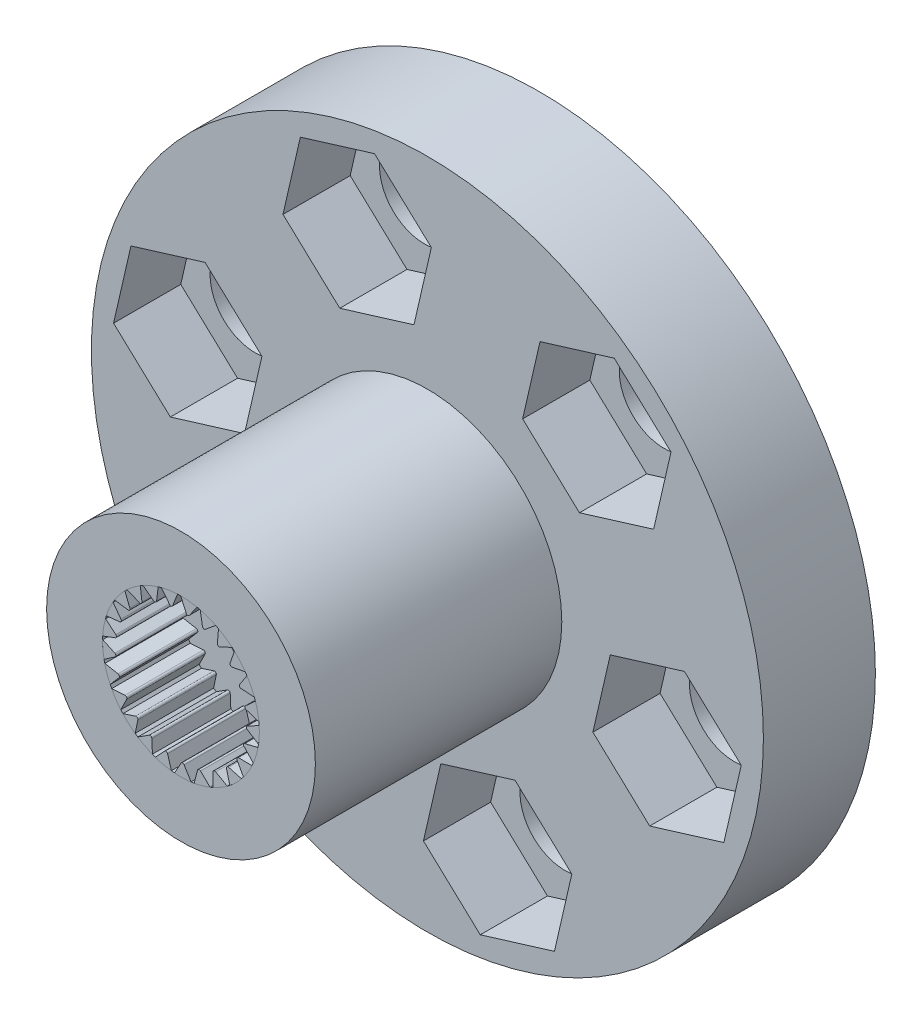
from build123d import *

# Parameters (mm, degrees)
SKETCH_1_R          = 15
EXTRUDE_1_DEPTH     = 5
SKETCH_2_R          = 2
CUT_EXTRUDE_1_DEPTH = 58.459224673
SKETCH_3_R          = 6
SKETCH_3_R_2        = 3.5
EXTRUDE_2_DEPTH     = 11
SKETCH_4_R          = 3.5
EXTRUDE_3_DEPTH     = 7.5
SKETCH_5_R          = 4
CUT_EXTRUDE_2_DEPTH = 10
SKETCH_6_R          = 1.5
CUT_EXTRUDE_3_DEPTH = 8
CUT_EXTRUDE_4_DEPTH = 3
EXTRUDE_4_DEPTH     = 3.5


with BuildPart() as part:
    # 草图1 → 凸台-拉伸1 (new body)
    with BuildSketch(Plane.XY):
        with Locations((-15, -33.75)):
            Circle(SKETCH_1_R)
    extrude(amount=EXTRUDE_1_DEPTH)

    # 草图2 → 切除-拉伸1 (cut, through all)
    with BuildSketch(Plane.XY.offset(5)):
        with Locations((-18.135560105, -23.206363871)):
            Circle(SKETCH_2_R)
        with Locations((-7.436723316, -25.76270723)):
            Circle(SKETCH_2_R)
        with Locations((-4.301163211, -36.306343359)):
            Circle(SKETCH_2_R)
        with Locations((-11.864439895, -44.293636129)):
            Circle(SKETCH_2_R)
        with Locations((-22.563276684, -41.73729277)):
            Circle(SKETCH_2_R)
        with Locations((-25.698836789, -31.193656641)):
            Circle(SKETCH_2_R)
    extrude(amount=-CUT_EXTRUDE_1_DEPTH, mode=Mode.SUBTRACT)

    # 草图3 → 凸台-拉伸2 (add)
    with BuildSketch(Plane.XY.offset(5)):
        with Locations((-15, -33.75)):
            Circle(SKETCH_3_R)
        with Locations((-15, -33.75)):
            Circle(SKETCH_3_R_2, mode=Mode.SUBTRACT)
    extrude(amount=EXTRUDE_2_DEPTH)

    # 草图4 → 凸台-拉伸3 (add)
    with BuildSketch(Plane.XY.offset(5)):
        with Locations((-15, -33.75)):
            Circle(SKETCH_4_R)
    extrude(amount=EXTRUDE_3_DEPTH)

    # 草图5 → 切除-拉伸2 (cut)
    with BuildSketch(Plane(origin=(0, 0, 0), x_dir=(-1, 0, 0), z_dir=(0, 0, -1))):
        with Locations((15, -33.75)):
            Circle(SKETCH_5_R)
    extrude(amount=-CUT_EXTRUDE_2_DEPTH, mode=Mode.SUBTRACT)

    # 草图6 → 切除-拉伸3 (cut)
    with BuildSketch(Plane(origin=(0, 0, 10), x_dir=(-1, 0, 0), z_dir=(0, 0, -1))):
        with Locations((15, -33.75)):
            Circle(SKETCH_6_R)
    extrude(amount=-CUT_EXTRUDE_3_DEPTH, mode=Mode.SUBTRACT)

    # 草图8 → 切除-拉伸4 (cut)
    with BuildSketch(Plane.XY.offset(5)):
        Polygon((-4.125116269, -24.746213861), (-6.661228872, -22.386524716), (-9.972835919, -23.403018084), (-10.748330363, -26.779200598), (-8.21221776, -29.138889744), (-4.900610713, -28.122396375), align=None)
        Polygon((-17.360065661, -19.830181357), (-20.671672708, -20.846674725), (-21.447167151, -24.222857239), (-18.911054548, -26.582546385), (-15.599447502, -25.566053016), (-14.823953058, -22.189870502), align=None)
        Polygon((-1.765050608, -38.666032505), (-0.989556165, -35.289849991), (-3.525668768, -32.930160845), (-6.837275814, -33.946654213), (-7.612770258, -37.322836727), (-5.076657655, -39.682525873), align=None)
        Polygon((-12.639934339, -47.669818643), (-9.328327292, -46.653325275), (-8.552832849, -43.277142761), (-11.088945452, -40.917453615), (-14.400552498, -41.933946984), (-15.176046942, -45.310129498), align=None)
        Polygon((-25.874883731, -42.753786139), (-23.338771128, -45.113475284), (-20.027164081, -44.096981916), (-19.251669637, -40.720799402), (-21.78778224, -38.361110256), (-25.099389287, -39.377603625), align=None)
        Polygon((-28.234949392, -28.833967495), (-29.010443835, -32.210150009), (-26.474331232, -34.569839155), (-23.162724186, -33.553345787), (-22.387229742, -30.177163273), (-24.923342345, -27.817474127), align=None)
    extrude(amount=-CUT_EXTRUDE_4_DEPTH, mode=Mode.SUBTRACT)


with BuildPart() as body_2:
    # 草图9 → 凸台-拉伸4 (new body)
    with BuildSketch(Plane.XY.offset(16)):
        with BuildLine():
            Line((-17.90861252, -33.196490101), (-18.372741639, -32.814792088))
            ThreePointArc((-18.372741639, -32.814792088), (-18.452665259, -33.176325345), (-18.493948882, -33.544278797))
            Line((-18.493948882, -33.544278797), (-17.931324146, -33.333180196))
            ThreePointArc((-17.931324146, -33.333180196), (-17.880509302, -33.27139143), (-17.90861252, -33.196490101))
        make_face()
        with BuildLine():
            Line((-17.954885423, -33.937222152), (-18.499357508, -33.682940102))
            ThreePointArc((-18.499357508, -33.682940102), (-18.486860516, -34.052991322), (-18.435340835, -34.41965166))
            Line((-18.435340835, -34.41965166), (-17.942890078, -34.075266028))
            ThreePointArc((-17.942890078, -34.075266028), (-17.909037916, -34.002781332), (-17.954885423, -33.937222152))
        make_face()
        with BuildLine():
            Line((-17.815492008, -34.666190346), (-18.406095876, -34.555301736))
            ThreePointArc((-18.406095876, -34.555301736), (-18.301963503, -34.910619241), (-18.16087769, -35.252947846))
            Line((-18.16087769, -35.252947846), (-17.769543403, -34.796914199))
            ThreePointArc((-17.769543403, -34.796914199), (-17.75478098, -34.718288053), (-17.815492008, -34.666190346))
        make_face()
        with BuildLine():
            Line((-17.499190876, -35.337590932), (-18.098816713, -35.3770633))
            ThreePointArc((-18.098816713, -35.3770633), (-17.90959198, -35.695321185), (-17.687804975, -35.991808292))
            Line((-17.687804975, -35.991808292), (-17.42217613, -35.452780901))
            ThreePointArc((-17.42217613, -35.452780901), (-17.427431023, -35.372953674), (-17.499190876, -35.337590932))
        make_face()
        with BuildLine():
            Line((-17.025856389, -35.90923734), (-17.596827499, -36.096590493))
            ThreePointArc((-17.596827499, -36.096590493), (-17.334400091, -36.357791444), (-17.045847588, -36.589807678))
            Line((-17.045847588, -36.589807678), (-16.922614623, -36.001655616))
            ThreePointArc((-16.922614623, -36.001655616), (-16.947556648, -35.925643147), (-17.025856389, -35.90923734))
        make_face()
        with BuildLine():
            Line((-16.425229895, -36.345210925), (-16.931670063, -36.668672775))
            ThreePointArc((-16.931670063, -36.668672775), (-16.61252926, -36.856404575), (-16.275342073, -37.009371504))
            Line((-16.275342073, -37.009371504), (-16.302248168, -36.409050528))
            ThreePointArc((-16.302248168, -36.409050528), (-16.345310126, -36.34162896), (-16.425229895, -36.345210925))
        make_face()
        with BuildLine():
            Line((-15.735050965, -36.618117864), (-16.145138692, -37.057364113))
            ThreePointArc((-16.145138692, -37.057364113), (-15.789337285, -37.159830883), (-15.424702125, -37.22413703))
            Line((-15.424702125, -37.22413703), (-15.600056671, -36.649367516))
            ThreePointArc((-15.600056671, -36.649367516), (-15.65853282, -36.594773194), (-15.735050965, -36.618117864))
        make_face()
        with BuildLine():
            Line((-14.998686079, -36.710810408), (-15.286654047, -37.2382416))
            ThreePointArc((-15.286654047, -37.2382416), (-14.916548345, -37.249004976), (-14.54737658, -37.22060975))
            Line((-14.54737658, -37.22060975), (-14.860161407, -36.70750658))
            ThreePointArc((-14.860161407, -36.70750658), (-14.930377476, -36.669169866), (-14.998686079, -36.710810408))
        make_face()
        with BuildLine():
            ThreePointArc((-14.410157873, -37.199940038), (-14.04900298, -37.118323718), (-13.69849103, -36.999011296))
            Line((-13.69849103, -36.999011296), (-14.129052716, -36.579814628))
            ThreePointArc((-14.129052716, -36.579814628), (-14.206596772, -36.560144359), (-14.262403752, -36.617464346))
            Line((-14.262403752, -36.617464346), (-14.410157873, -37.199940038))
        make_face()
        with BuildLine():
            ThreePointArc((-13.570723649, -36.944866055), (-13.241212254, -36.775998292), (-12.931384075, -36.573265513))
            Line((-12.931384075, -36.573265513), (-13.452668846, -36.274315016))
            ThreePointArc((-13.452668846, -36.274315016), (-13.532668509, -36.274547147), (-13.57246731, -36.343944953))
            Line((-13.57246731, -36.343944953), (-13.570723649, -36.944866055))
        make_face()
        with BuildLine():
            ThreePointArc((-12.821096115, -36.489046889), (-12.543932632, -36.243538266), (-12.294255867, -35.970123574))
            Line((-12.294255867, -35.970123574), (-12.873509483, -35.810203408))
            ThreePointArc((-12.873509483, -35.810203408), (-12.950938081, -35.830323353), (-12.972227997, -35.907438459))
            Line((-12.972227997, -35.907438459), (-12.821096115, -36.489046889))
        make_face()
        with BuildLine():
            Line((-17.679580795, -32.490537113), (-18.034204008, -32.005406627))
            ThreePointArc((-18.034204008, -32.005406627), (-18.201526345, -32.335705455), (-18.33301927, -32.681832154))
            Line((-18.33301927, -32.681832154), (-17.735572338, -32.617284685))
            ThreePointArc((-17.735572338, -32.617284685), (-17.670987694, -32.570074265), (-17.679580795, -32.490537113))
        make_face()
        with BuildLine():
            Line((-17.282181154, -31.86372081), (-17.505016181, -31.305640383))
            ThreePointArc((-17.505016181, -31.305640383), (-17.749223757, -31.583950893), (-17.962663799, -31.886502425))
            Line((-17.962663799, -31.886502425), (-17.367934459, -31.972561844))
            ThreePointArc((-17.367934459, -31.972561844), (-17.293638106, -31.942896174), (-17.282181154, -31.86372081))
        make_face()
        with BuildLine():
            Line((-16.741383677, -31.355426366), (-16.818428974, -30.759462244))
            ThreePointArc((-16.818428974, -30.759462244), (-17.12417733, -30.968297163), (-17.406153266, -31.208263102))
            Line((-17.406153266, -31.208263102), (-16.851510549, -31.439521979))
            ThreePointArc((-16.851510549, -31.439521979), (-16.772170801, -31.429265062), (-16.741383677, -31.355426366))
        make_face()
        with BuildLine():
            Line((-16.09116866, -30.99759179), (-16.017583186, -30.401190591))
            ThreePointArc((-16.017583186, -30.401190591), (-16.193292596, -30.459703238), (-16.365661028, -30.527428053))
            Line((-16.365661028, -30.527428053), (-16.139351486, -31.061454261))
            ThreePointArc((-16.139351486, -31.061454261), (-16.106704124, -31.0359783), (-16.09116866, -30.99759179))
        make_face()
        with BuildLine():
            Line((-16.139351486, -31.061454261), (-16.365661028, -30.527428053))
            ThreePointArc((-16.365661028, -30.527428053), (-16.534205885, -30.604175418), (-16.698455274, -30.689730456))
            Line((-16.698455274, -30.689730456), (-16.218749422, -31.051657945))
            ThreePointArc((-16.218749422, -31.051657945), (-16.180362912, -31.067193409), (-16.139351486, -31.061454261))
        make_face()
        with BuildLine():
            ThreePointArc((-15.509409787, -30.833340666), (-15.434942528, -30.862574677), (-15.372391503, -30.812701144))
            Line((-15.372391503, -30.812701144), (-15.152798905, -30.253336949))
            ThreePointArc((-15.152798905, -30.253336949), (-15.521335222, -30.289044989), (-15.884037091, -30.363485801))
            Line((-15.884037091, -30.363485801), (-15.509409787, -30.833340666))
        make_face()
        with BuildLine():
            ThreePointArc((-14.278413707, -30.325191506), (-14.644252006, -30.268126458), (-15.014071606, -30.250028287))
            Line((-15.014071606, -30.250028287), (-14.768062061, -30.79828782))
            ThreePointArc((-14.768062061, -30.79828782), (-14.703204531, -30.845122645), (-14.630215618, -30.812371788))
            Line((-14.630215618, -30.812371788), (-14.278413707, -30.325191506))
        make_face()
        with BuildLine():
            ThreePointArc((-13.449368429, -30.612239376), (-13.789521745, -30.465986846), (-14.143221951, -30.356486868))
            Line((-14.143221951, -30.356486868), (-14.041287849, -30.948701906))
            ThreePointArc((-14.041287849, -30.948701906), (-13.990115284, -31.01019474), (-13.911274646, -30.996624417))
            Line((-13.911274646, -30.996624417), (-13.449368429, -30.612239376))
        make_face()
        with BuildLine():
            ThreePointArc((-12.717755036, -31.096444286), (-13.010850285, -30.870193859), (-13.326206811, -30.67617236))
            Line((-13.326206811, -30.67617236), (-13.374753047, -31.275131854))
            ThreePointArc((-13.374753047, -31.275131854), (-13.340480809, -31.347418877), (-13.260742292, -31.353881759))
            Line((-13.260742292, -31.353881759), (-12.717755036, -31.096444286))
        make_face()
        with BuildLine():
            ThreePointArc((-12.129543487, -31.747381861), (-12.357164416, -31.455349683), (-12.614362253, -31.188997747))
            Line((-12.614362253, -31.188997747), (-12.810338489, -31.757066869))
            ThreePointArc((-12.810338489, -31.757066869), (-12.795120027, -31.835606021), (-12.719493896, -31.861696023))
            Line((-12.719493896, -31.861696023), (-12.129543487, -31.747381861))
        make_face()
        with BuildLine():
            ThreePointArc((-11.721693278, -32.524151299), (-11.869537628, -32.184686825), (-12.052416088, -31.862740325))
            Line((-12.052416088, -31.862740325), (-12.383508416, -32.364225202))
            ThreePointArc((-12.383508416, -32.364225202), (-12.388299964, -32.44408158), (-12.321538086, -32.488159371))
            Line((-12.321538086, -32.488159371), (-11.721693278, -32.524151299))
        make_face()
        with BuildLine():
            ThreePointArc((-11.519831137, -33.377945319), (-11.578609303, -33.012378351), (-11.675677461, -32.655066368))
            Line((-11.675677461, -32.655066368), (-12.121082132, -33.058456862))
            ThreePointArc((-12.121082132, -33.058456862), (-12.145582618, -33.134612796), (-12.091879888, -33.193908806))
            Line((-12.091879888, -33.193908806), (-11.519831137, -33.377945319))
        make_face()
        with BuildLine():
            ThreePointArc((-11.5, -33.75), (-11.501955107, -33.63303022), (-11.507818245, -33.516191119))
            Line((-11.507818245, -33.516191119), (-12.039548846, -33.796140721))
            ThreePointArc((-12.039548846, -33.796140721), (-12.082218815, -33.863811053), (-12.044949573, -33.934599496))
            Line((-12.044949573, -33.934599496), (-11.536640805, -34.255116903))
            ThreePointArc((-11.536640805, -34.255116903), (-11.50917222, -34.003222054), (-11.5, -33.75))
        make_face()
        with BuildLine():
            ThreePointArc((-11.771066068, -35.100550134), (-11.646460538, -34.751884761), (-11.559385653, -34.392006941))
            Line((-11.559385653, -34.392006941), (-12.144031594, -34.530925389))
            ThreePointArc((-12.144031594, -34.530925389), (-12.202189934, -34.585858143), (-12.183695944, -34.66369112))
            Line((-12.183695944, -34.66369112), (-11.771066068, -35.100550134))
        make_face()
        with BuildLine():
            ThreePointArc((-12.208377126, -35.861123333), (-12.000976755, -35.554400059), (-11.827139513, -35.227483106))
            Line((-11.827139513, -35.227483106), (-12.42796534, -35.216641643))
            ThreePointArc((-12.42796534, -35.216641643), (-12.49795775, -35.255385192), (-12.499401056, -35.335372172))
            Line((-12.499401056, -35.335372172), (-12.208377126, -35.861123333))
        make_face()
    extrude(amount=-EXTRUDE_4_DEPTH)


solid = Compound([part.part, body_2.part])
